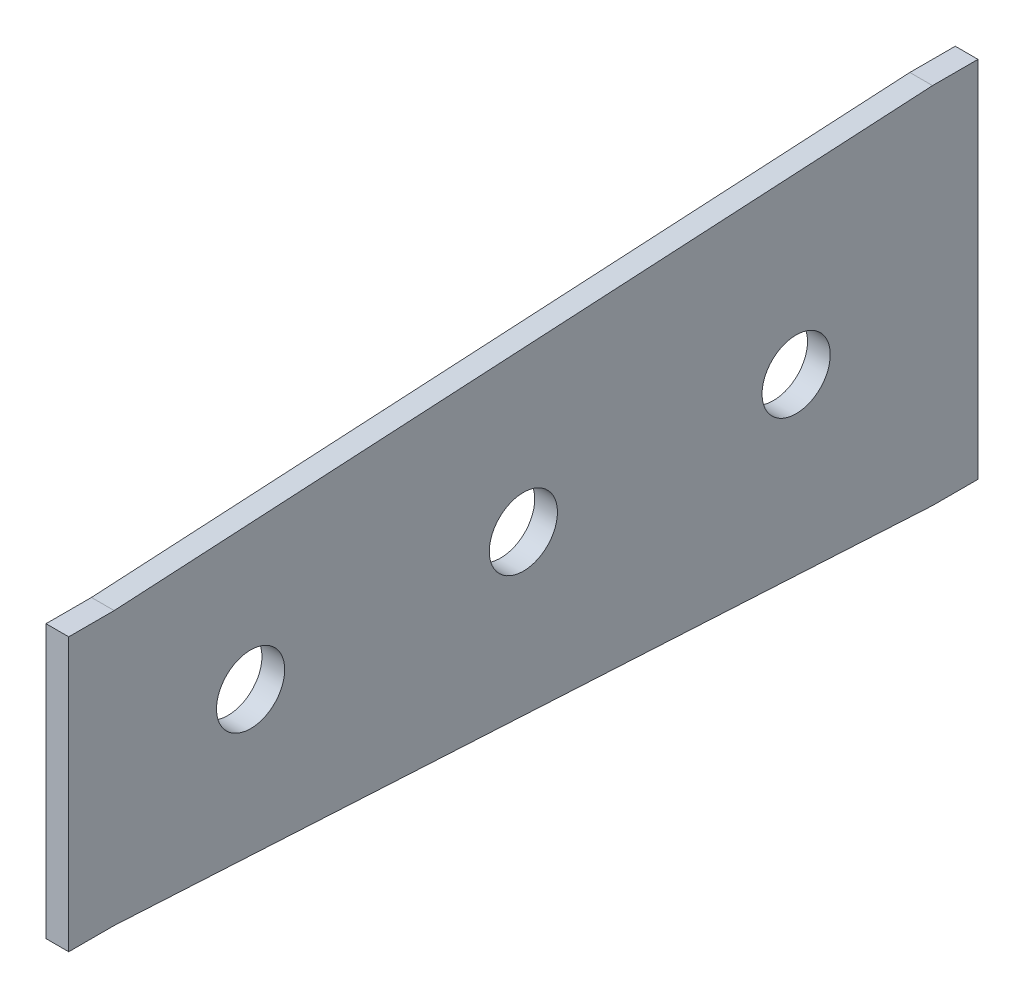
from build123d import *

# Parameters (mm, degrees)
SKETCH1_R           = 7.5
BOSS_EXTRUDE1_DEPTH = 2.5


with BuildPart() as part:
    # Sketch1 → Boss-Extrude1 (new, symmetric)
    with BuildSketch(Plane(origin=(0, 0, 0), x_dir=(0, 0, -1), z_dir=(1, 0, 0))):
        Polygon((100, -40), (100, 40), (90, 40), (-90, 30), (-100, 30), (-100, -30), (-90, -30), (90, -40), align=None)
        Circle(SKETCH1_R, mode=Mode.SUBTRACT)
        with Locations((-60, 0)):
            Circle(SKETCH1_R, mode=Mode.SUBTRACT)
        with Locations((60, 0)):
            Circle(SKETCH1_R, mode=Mode.SUBTRACT)
    extrude(amount=BOSS_EXTRUDE1_DEPTH, both=True)


solid = part.part
